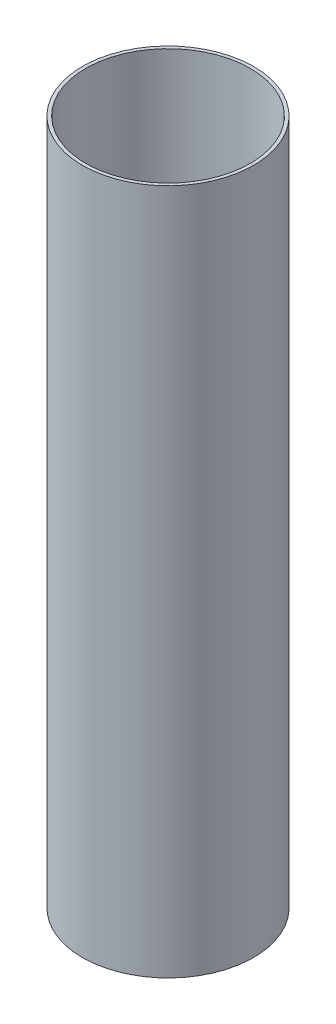
from build123d import *

# Parameters (mm, degrees)
SKETCH1_R           = 39.624
SKETCH1_R_2         = 38.1
BOSS_EXTRUDE1_DEPTH = 317.5


with BuildPart() as part:
    # Sketch1 → Boss-Extrude1 (new body)
    with BuildSketch(Plane(origin=(0, 0, 0), x_dir=(1, 0, 0), z_dir=(0, 1, 0))):
        with Locations(Location((0, 0, 0), (0, 0, 90))):
            Circle(SKETCH1_R)
        with Locations(Location((0, 0, 0), (0, 0, 90))):
            Circle(SKETCH1_R_2, mode=Mode.SUBTRACT)
    extrude(amount=BOSS_EXTRUDE1_DEPTH)


solid = part.part
